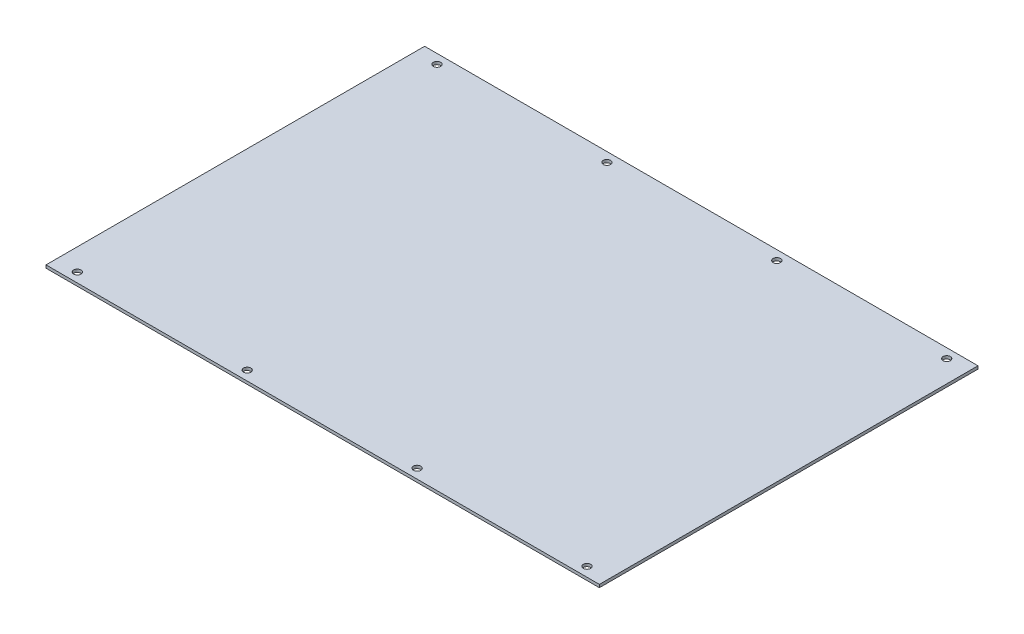
from build123d import *

# Parameters (mm, degrees)
SKETCH_1_W      = 380
SKETCH_1_H      = 260
EXTRUDE_1_DEPTH = 2
MM_1_D          = 5
MM_2_D          = 5


with BuildPart() as part:
    # 草图1 → 凸台-拉伸1 (new body)
    with BuildSketch(Plane(origin=(0, 0, 0), x_dir=(1, 0, 0), z_dir=(0, 1, 0))):
        Rectangle(SKETCH_1_W, SKETCH_1_H)
    extrude(amount=EXTRUDE_1_DEPTH)

    # 大小mm 暗销孔1 (through all)
    with Locations(Plane(origin=(86.042395626, 220, 442.05931397), x_dir=(-0.9930068269996722, 0, 0.11805694190534984), z_dir=(0, 1, 0))):
        with Locations((192.458607988, -592.42330735), (76.604501482, -578.649603938), (-39.249605024, -564.875900526), (-155.10371153, -551.102197114), (-125.953576947, -305.828330275), (-10.099470441, -319.602033687), (105.754636065, -333.375737099), (221.608742571, -347.149440512)):
            Hole(MM_1_D / 2)

    # 大小mm 暗销孔2 (through all)
    with Locations(Plane(origin=(86.042395626, 2, 442.05931397), x_dir=(-0.9930068269996722, 0, 0.11805694190534984), z_dir=(0, 1, 0))):
        with Locations((192.458607988, -592.42330735), (76.604501482, -578.649603938), (-39.249605024, -564.875900526), (-155.10371153, -551.102197114), (-125.953576947, -305.828330275), (-10.099470441, -319.602033687), (105.754636065, -333.375737099), (221.608742571, -347.149440512)):
            Hole(MM_2_D / 2)


solid = part.part
